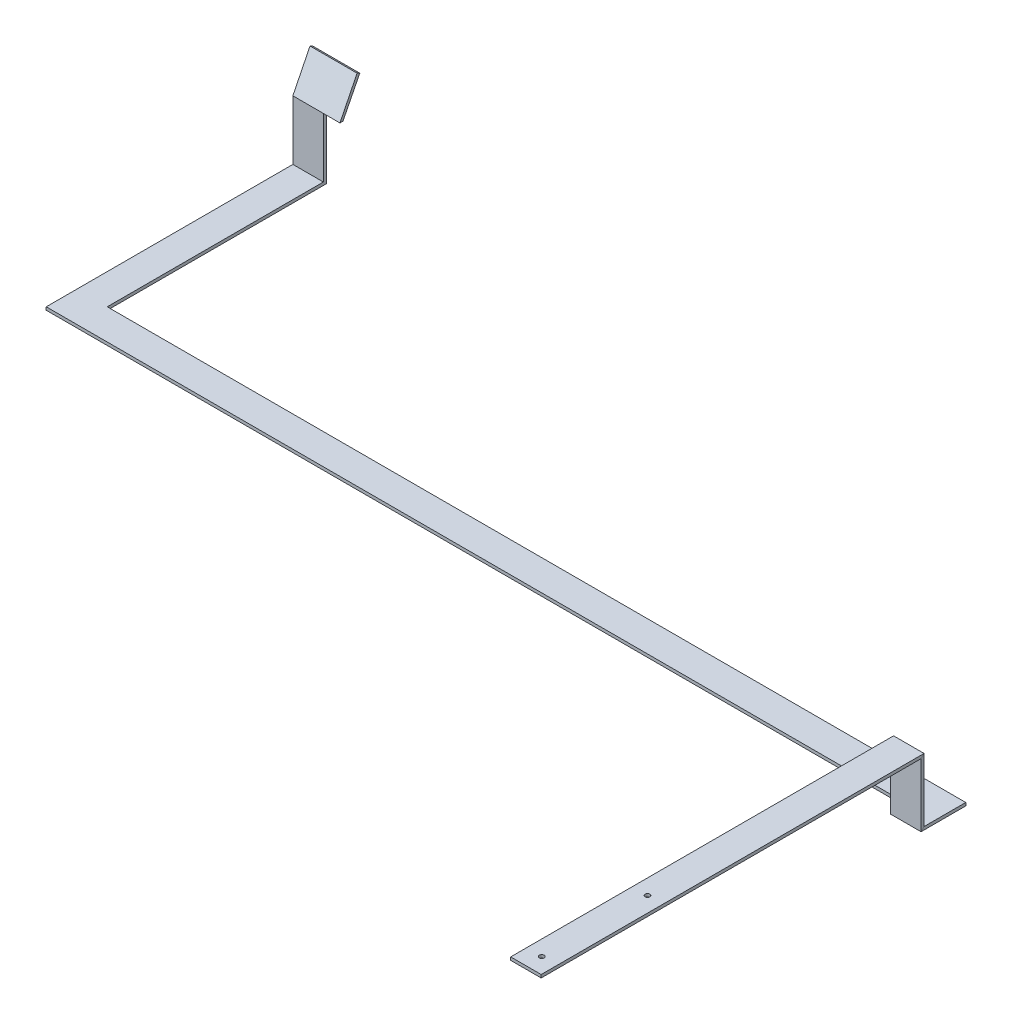
from build123d import *

# Parameters (mm, degrees)
CROQUIS2_W              = 63.5
CROQUIS2_H              = 130
SALIENTE_EXTRUIR1_DEPTH = 6.31
CROQUIS3_W              = 63.5
CROQUIS3_H              = 6.31
SALIENTE_EXTRUIR2_DEPTH = 513.44
CROQUIS4_W              = 63.5
CROQUIS4_H              = 6.31
SALIENTE_EXTRUIR3_DEPTH = 1787.3
CROQUIS9_W              = 63.5
CROQUIS9_H              = 6.31
SALIENTE_EXTRUIR4_DEPTH = 98
CROQUIS12_R             = 5
CORTAR_EXTRUIR1_DEPTH   = 10


with BuildPart() as part:
    # Croquis2 → Saliente-Extruir1 (new body)
    with BuildSketch(Plane.XY):
        Rectangle(CROQUIS2_W, CROQUIS2_H)
    extrude(amount=SALIENTE_EXTRUIR1_DEPTH)

    # Croquis3 → Saliente-Extruir2 (add)
    with BuildSketch(Plane.XY.offset(6.31)):
        with Locations((0, -61.845)):
            Rectangle(CROQUIS3_W, CROQUIS3_H)
    extrude(amount=SALIENTE_EXTRUIR2_DEPTH)

    # Croquis4 → Saliente-Extruir3 (add)
    with BuildSketch(Plane(origin=(31.75, 0, 0), x_dir=(0, 0, -1), z_dir=(1, 0, 0))):
        with Locations((-488, -61.845)):
            Rectangle(CROQUIS4_W, CROQUIS4_H)
    extrude(amount=SALIENTE_EXTRUIR3_DEPTH)

    # Barrer2: sweep along a curve in space
    with BuildLine() as barrer2_path:
        Line((1787.3, -61.845, 519.75), (1787.3, -61.845, 546.16))
        Line((1787.3, -61.845, 546.16), (1787.3, 69.915, 546.16))
        Line((1787.3, 69.915, 546.16), (1787.3, 69.915, 1340.16))
    # Croquis9 → Barrer2 (sweep)
    with BuildSketch(Plane.XY.offset(519.75)):
        with Locations((1787.3, -61.845)):
            Rectangle(CROQUIS9_W, CROQUIS9_H)
    sweep(path=barrer2_path.line, transition=Transition.RIGHT)

    # Croquis11 → Saliente-Extruir4 (add)
    with BuildSketch(Plane.ZY.offset(31.75)):
        Polygon((0, 65), (-35.006192049, 134.080780284), (-29.377619212, 136.933019371), (6.31, 65), align=None)
    extrude(amount=-SALIENTE_EXTRUIR4_DEPTH)

    # Croquis12 → Cortar-Extruir1 (cut)
    with BuildSketch(Plane(origin=(0, 73.07, 0), x_dir=(1, 0, 0), z_dir=(0, 1, 0))):
        with Locations(Location((1787.3, -1307.16, 0), (0, 0, 270))):
            Circle(CROQUIS12_R)
        with Locations(Location((1787.3, -1087.16, 0), (0, 0, 270))):
            Circle(CROQUIS12_R)
    extrude(amount=-CORTAR_EXTRUIR1_DEPTH, mode=Mode.SUBTRACT)


solid = part.part
